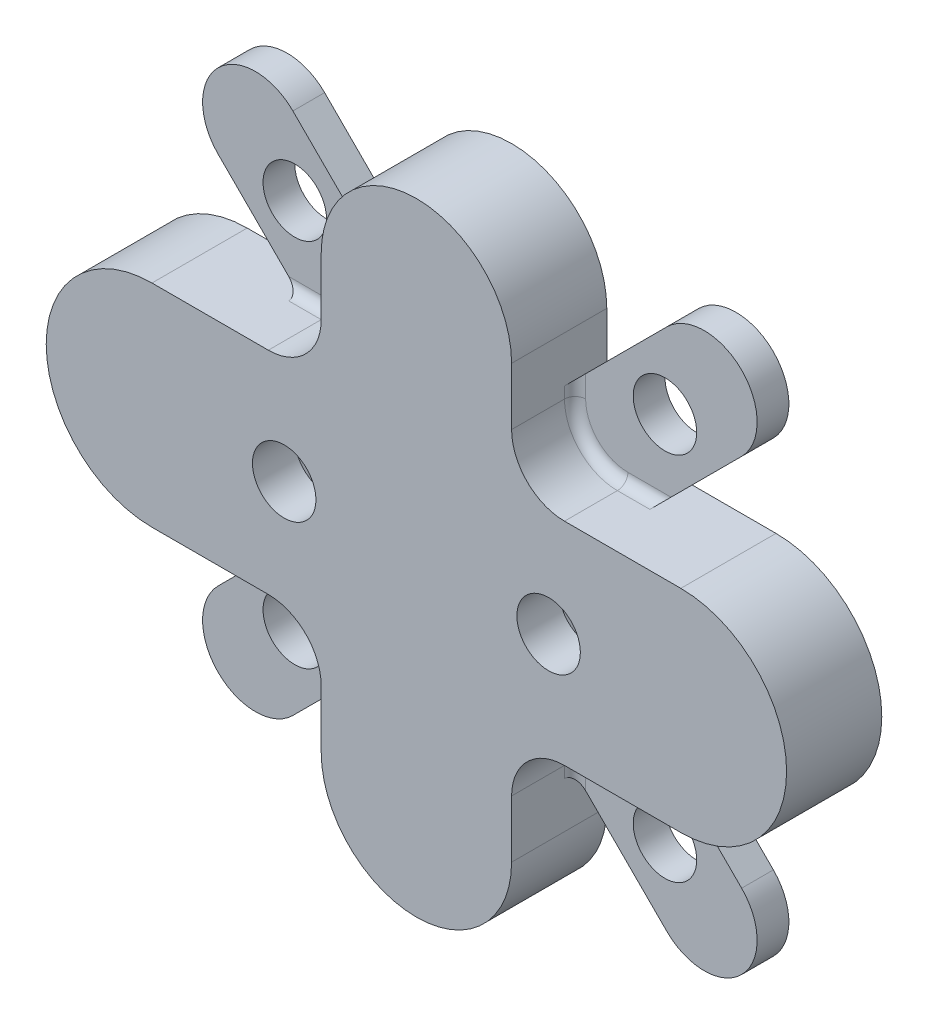
from build123d import *

# Parameters (mm, degrees)
SKETCH1_R           = 3
BOSS_EXTRUDE2_DEPTH = 9
BOSS_EXTRUDE3_DEPTH = 9
CUT_EXTRUDE4_DEPTH  = 5
CUT_EXTRUDE5_START  = -6
SKETCH4_R           = 3
CUT_EXTRUDE5_DEPTH  = 6
FILLET1_R           = 5
FILLET2_R           = 1


with BuildPart() as part:
    # Sketch1 → Boss-Extrude2 (new body)
    # profile 1 of 3: a face of its own
    with BuildSketch(Plane.XY):
        with BuildLine():
            Line((17.67766953, -24.748737342), (-24.748737342, 17.67766953))
            ThreePointArc((-24.748737342, 17.67766953), (-24.748737342, 24.748737342), (-17.67766953, 24.748737342))
            Line((-17.67766953, 24.748737342), (24.748737342, -17.67766953))
            ThreePointArc((24.748737342, -17.67766953), (24.748737342, -24.748737342), (17.67766953, -24.748737342))
        make_face()
        with Locations((-17.5, 17.5)):
            Circle(SKETCH1_R, mode=Mode.SUBTRACT)
        with Locations((17.5, -17.5)):
            Circle(SKETCH1_R, mode=Mode.SUBTRACT)
    # profile 2 of 3: a face of its own
    with BuildSketch(Plane.XY):
        with BuildLine():
            Line((-24.748737342, -17.67766953), (17.67766953, 24.748737342))
            ThreePointArc((17.67766953, 24.748737342), (24.748737342, 24.748737342), (24.748737342, 17.67766953))
            Line((24.748737342, 17.67766953), (-17.67766953, -24.748737342))
            ThreePointArc((-17.67766953, -24.748737342), (-24.748737342, -24.748737342), (-24.748737342, -17.67766953))
        make_face()
        with Locations((17.5, 17.5)):
            Circle(SKETCH1_R, mode=Mode.SUBTRACT)
        with Locations((-17.5, -17.5)):
            Circle(SKETCH1_R, mode=Mode.SUBTRACT)
    # profile 3 of 3: a face of its own
    with BuildSketch(Plane.XY):
        with BuildLine():
            Line((-25, 10), (25, 10))
            ThreePointArc((25, 10), (35, 0), (25, -10))
            Line((25, -10), (-25, -10))
            ThreePointArc((-25, -10), (-35, 0), (-25, 10))
        make_face()
        with Locations((12.5, 0)):
            Circle(SKETCH1_R, mode=Mode.SUBTRACT)
        with Locations((-12.5, 0)):
            Circle(SKETCH1_R, mode=Mode.SUBTRACT)
    extrude(amount=BOSS_EXTRUDE2_DEPTH)

    # Sketch5 → Boss-Extrude3 (add)
    with BuildSketch(Plane.XY.offset(9)):
        with BuildLine():
            Line((9, 20.422973397), (9, -20.422973397))
            ThreePointArc((9, -20.422973397), (0, -29.422973397), (-9, -20.422973397))
            Line((-9, -20.422973397), (-9, 20.422973397))
            ThreePointArc((-9, 20.422973397), (0, 29.422973397), (9, 20.422973397))
        make_face()
    extrude(amount=-BOSS_EXTRUDE3_DEPTH)

    # Sketch6 → Cut-Extrude4 (cut)
    with BuildSketch(Plane(origin=(0, 0, 0), x_dir=(-1, 0, 0), z_dir=(0, 0, -1))):
        Polygon((-6.611027254, 0), (-9.555513627, 5.1), (-15.444486373, 5.1), (-18.388972746, 0), (-15.444486373, -5.1), (-9.555513627, -5.1), align=None)
        Polygon((17.886314115, 0.120263137), (14.941827742, 5.220263137), (9.052854996, 5.220263137), (6.108368623, 0.120263137), (9.052854996, -4.979736863), (14.941827742, -4.979736863), align=None)
    extrude(amount=-CUT_EXTRUDE4_DEPTH, mode=Mode.SUBTRACT)

    # Sketch4 → Cut-Extrude5 (cut)
    # profile 1 of 8: a face of its own
    with BuildSketch(Plane.XY.offset(9).offset(CUT_EXTRUDE5_START)):
        with BuildLine():
            Line((-9, 26.683350041), (-29.894469541, 26.683350041))
            Line((-29.894469541, 26.683350041), (-29.894469541, 10))
            Line((-29.894469541, 10), (-25, 10))
            Line((-25, 10), (-17.071067812, 10))
            Line((-17.071067812, 10), (-24.748737342, 17.67766953))
            ThreePointArc((-24.748737342, 17.67766953), (-24.748737342, 24.748737342), (-17.67766953, 24.748737342))
            Line((-17.67766953, 24.748737342), (-9, 16.071067812))
            Line((-9, 16.071067812), (-9, 20.422973397))
            Line((-9, 20.422973397), (-9, 26.683350041))
        make_face()
    # profile 2 of 8: a face of its own
    with BuildSketch(Plane.XY.offset(9).offset(CUT_EXTRUDE5_START)):
        with BuildLine():
            Line((-9, 10), (-9, 16.071067812))
            Line((-9, 16.071067812), (-17.67766953, 24.748737342))
            ThreePointArc((-17.67766953, 24.748737342), (-24.748737342, 24.748737342), (-24.748737342, 17.67766953))
            Line((-24.748737342, 17.67766953), (-17.071067812, 10))
            Line((-17.071067812, 10), (-9, 10))
        make_face()
        with Locations((-17.5, 17.5)):
            Circle(SKETCH4_R, mode=Mode.SUBTRACT)
    # profile 3 of 8: a face of its own
    with BuildSketch(Plane.XY.offset(9).offset(CUT_EXTRUDE5_START)):
        with BuildLine():
            Line((25, 10), (29.894469541, 10))
            Line((29.894469541, 10), (29.894469541, 26.683350041))
            Line((29.894469541, 26.683350041), (9, 26.683350041))
            Line((9, 26.683350041), (9, 20.422973397))
            Line((9, 20.422973397), (9, 16.071067812))
            Line((9, 16.071067812), (17.67766953, 24.748737342))
            ThreePointArc((17.67766953, 24.748737342), (24.748737342, 24.748737342), (24.748737342, 17.67766953))
            Line((24.748737342, 17.67766953), (17.071067812, 10))
            Line((17.071067812, 10), (25, 10))
        make_face()
    # profile 4 of 8: a face of its own
    with BuildSketch(Plane.XY.offset(9).offset(CUT_EXTRUDE5_START)):
        with BuildLine():
            Line((9, 10), (17.071067812, 10))
            Line((17.071067812, 10), (24.748737342, 17.67766953))
            ThreePointArc((24.748737342, 17.67766953), (24.748737342, 24.748737342), (17.67766953, 24.748737342))
            Line((17.67766953, 24.748737342), (9, 16.071067812))
            Line((9, 16.071067812), (9, 10))
        make_face()
        with Locations((17.5, 17.5)):
            Circle(SKETCH4_R, mode=Mode.SUBTRACT)
    # profile 5 of 8: a face of its own
    with BuildSketch(Plane.XY.offset(9).offset(CUT_EXTRUDE5_START)):
        with BuildLine():
            Line((9, -26.683350041), (29.894469541, -26.683350041))
            Line((29.894469541, -26.683350041), (29.894469541, -10))
            Line((29.894469541, -10), (25, -10))
            Line((25, -10), (17.071067812, -10))
            Line((17.071067812, -10), (24.748737342, -17.67766953))
            ThreePointArc((24.748737342, -17.67766953), (24.748737342, -24.748737342), (17.67766953, -24.748737342))
            Line((17.67766953, -24.748737342), (9, -16.071067812))
            Line((9, -16.071067812), (9, -20.422973397))
            Line((9, -20.422973397), (9, -26.683350041))
        make_face()
    # profile 6 of 8: a face of its own
    with BuildSketch(Plane.XY.offset(9).offset(CUT_EXTRUDE5_START)):
        with BuildLine():
            Line((24.748737342, -17.67766953), (17.071067812, -10))
            Line((17.071067812, -10), (9, -10))
            Line((9, -10), (9, -16.071067812))
            Line((9, -16.071067812), (17.67766953, -24.748737342))
            ThreePointArc((17.67766953, -24.748737342), (24.748737342, -24.748737342), (24.748737342, -17.67766953))
        make_face()
        with Locations((17.5, -17.5)):
            Circle(SKETCH4_R, mode=Mode.SUBTRACT)
    # profile 7 of 8: a face of its own
    with BuildSketch(Plane.XY.offset(9).offset(CUT_EXTRUDE5_START)):
        with BuildLine():
            Line((-9, -10), (-17.071067812, -10))
            Line((-17.071067812, -10), (-24.748737342, -17.67766953))
            ThreePointArc((-24.748737342, -17.67766953), (-24.748737342, -24.748737342), (-17.67766953, -24.748737342))
            Line((-17.67766953, -24.748737342), (-9, -16.071067812))
            Line((-9, -16.071067812), (-9, -10))
        make_face()
        with Locations((-17.5, -17.5)):
            Circle(SKETCH4_R, mode=Mode.SUBTRACT)
    # profile 8 of 8: a face of its own
    with BuildSketch(Plane.XY.offset(9).offset(CUT_EXTRUDE5_START)):
        with BuildLine():
            Line((-25, -10), (-29.894469541, -10))
            Line((-29.894469541, -10), (-29.894469541, -26.683350041))
            Line((-29.894469541, -26.683350041), (-9, -26.683350041))
            Line((-9, -26.683350041), (-9, -20.422973397))
            Line((-9, -20.422973397), (-9, -16.071067812))
            Line((-9, -16.071067812), (-17.67766953, -24.748737342))
            ThreePointArc((-17.67766953, -24.748737342), (-24.748737342, -24.748737342), (-24.748737342, -17.67766953))
            Line((-24.748737342, -17.67766953), (-17.071067812, -10))
            Line((-17.071067812, -10), (-25, -10))
        make_face()
    extrude(amount=CUT_EXTRUDE5_DEPTH, mode=Mode.SUBTRACT)

    # Fillet1
    fillet1_edges = [part.edges().sort_by_distance(p)[0] for p in [
        (-9, -10, 6),
        (9, -10, 6),
        (9, 10, 6),
        (-9, 10, 6),
    ]]
    fillet(fillet1_edges, radius=FILLET1_R)

    # Fillet2
    fillet2_edges = [part.edges().sort_by_distance(p)[0] for p in [
        (-9, -15.535533906, 3),
        (-15.535533906, -10, 3),
        (15.535533906, -10, 3),
        (9, -15.535533906, 3),
        (9, 15.535533906, 3),
        (15.535533906, 10, 3),
        (-15.535533906, 10, 3),
        (-9, 15.535533906, 3),
        (10.464466094, 11.464466094, 3),
        (-10.464466094, 11.464466094, 3),
        (-10.464466094, -11.464466094, 3),
        (10.464466094, -11.464466094, 3),
    ]]
    fillet(fillet2_edges, radius=FILLET2_R)


solid = part.part
